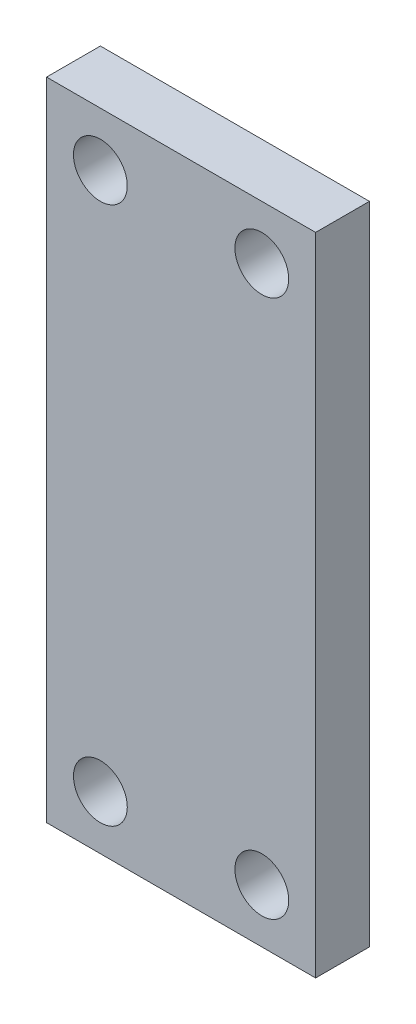
from build123d import *

# Parameters (mm, degrees)
SKETCH1_W           = 25
SKETCH1_H           = 60
SKETCH1_R           = 2.5
BOSS_EXTRUDE1_DEPTH = 5


with BuildPart() as part:
    # Sketch1 → Boss-Extrude1 (new body)
    with BuildSketch(Plane.XY):
        Rectangle(SKETCH1_W, SKETCH1_H)
        with Locations((7.5, 25)):
            Circle(SKETCH1_R, mode=Mode.SUBTRACT)
        with Locations(Location((-7.5, 25, 0), (0, 0, 180))):
            Circle(SKETCH1_R, mode=Mode.SUBTRACT)
        with Locations(Location((7.5, -25, 0), (0, 0, 180))):
            Circle(SKETCH1_R, mode=Mode.SUBTRACT)
        with Locations((-7.5, -25)):
            Circle(SKETCH1_R, mode=Mode.SUBTRACT)
    extrude(amount=BOSS_EXTRUDE1_DEPTH)


solid = part.part
